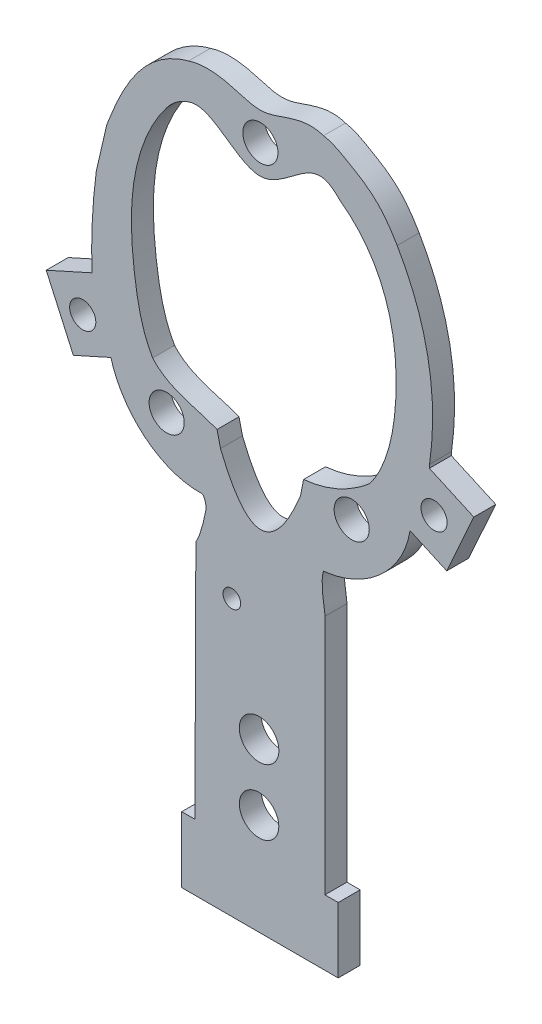
from build123d import *

# Parameters (mm, degrees)
BOSS_EXTRUDE1_START   = -1
SKETCH1_R             = 0.8
BOSS_EXTRUDE1_DEPTH   = 1
SKETCH7_R             = 0.898548633
SKETCH7_R_2           = 0.900820611
SKETCH7_R_3           = 0.402256278
CUT_EXTRUDE9_DEPTH    = 10
F_0_80_TAPPED_HOLE2_D = 1.19126
F_0_80_TAPPED_HOLE3_D = 1.19126


with BuildPart() as part:
    # Sketch1 → Boss-Extrude1 (new body)
    with BuildSketch(Plane.XY.offset(BOSS_EXTRUDE1_START)):
        with BuildLine():
            Line((-7.655924922, -1.783859884), (-9.740911438, -2.722813484))
            Line((-9.740911438, -2.722813484), (-8.506978823, -5.462813484))
            Line((-8.506978823, -5.462813484), (-6.79791054, -4.69315104))
            add(Edge.make_bspline(
                [(-2.619308836, -7.990994312), (-4.588919021, -8.061513983), (-6.291403266, -6.510208965), (-6.79791054, -4.69315104)],
                knots=[0, 0, 0, 0, 1, 1, 1, 1], degree=3))
            add(Edge.make_bspline(
                [(-2.619308836, -7.990994312), (-2.465518072, -8.186748708), (-2.460868626, -8.496086459)],
                knots=[0.760656089, 0.760656089, 0.760656089, 1, 1, 1], degree=2))
            add(Edge.make_bspline(
                [(-2.460868626, -8.496086459), (-2.65493709, -9.55970155), (-2.927067031, -10.028695592)],
                knots=[0.505400696, 0.505400696, 0.505400696, 1, 1, 1], degree=2))
            Line((-2.927067031, -10.028695592), (-2.968919318, -20.993587767))
            Line((-2.968919318, -20.993587767), (-3.569337553, -20.993587767))
            Line((-3.569337553, -20.993587767), (-3.569337553, -23.990261353))
            Line((-3.569337553, -23.990261353), (3.556946411, -23.990261353))
            Line((3.556946411, -23.990261353), (3.556946411, -21.012656051))
            Line((3.556946411, -21.012656051), (2.952210653, -21.012656051))
            Line((2.952210653, -21.012656051), (2.952210653, -10.028695592))
            add(Edge.make_bspline(
                [(2.952210653, -10.028695592), (2.953361032, -9.730287058), (2.715766736, -8.848177203), (2.885688703, -8.273229584)],
                knots=[0, 0, 0, 0, 0.672395154, 0.672395154, 0.672395154, 0.672395154], degree=3))
            add(Edge.make_bspline(
                [(6.826829986, -4.71005972), (6.530666267, -6.607497463), (4.761489994, -8.103944733), (2.885688703, -8.273229584)],
                knots=[0, 0, 0, 0, 1, 1, 1, 1], degree=3))
            Line((6.826829986, -4.71005972), (8.498351825, -5.462813484))
            Line((8.498351825, -5.462813484), (9.73228444, -2.722813484))
            Line((9.73228444, -2.722813484), (7.707819022, -1.811114978))
            Line((7.707819022, -1.811114978), (7.717081791, -1.649283667))
            add(Edge.make_bspline(
                [(6.242730234, 6.243460256), (8.328472862, 2.657233336), (7.717081791, -1.649283667)],
                knots=[0, 0, 0, 1, 1, 1], degree=2))
            add(Edge.make_bspline(
                [(2.888581262, 8.896214027), (2.985217378, 8.879515932), (3.247765026, 8.808593113), (3.630118411, 8.642577), (4.074173184, 8.36866418), (4.721906948, 8.009989726), (5.550196572, 7.346039296), (6.012892554, 6.633136043), (6.242724869, 6.243469352), (6.242730234, 6.243460256)],
                knots=[0.680120302, 0.680120302, 0.680120302, 0.680120302, 0.700211116, 0.734681827, 0.764415496, 0.805837959, 0.884920242, 0.976406366, 0.976408502, 0.976408502, 0.976408502, 0.976408502], degree=3))
            add(Edge.make_bspline(
                [(2.888581262, 8.896214027), (2.280334466, 9.102116147), (1.335962581, 8.833175098), (-0.021268554, 8.319279629), (-1.467178457, 8.865773987), (-2.595326146, 8.990746146), (-3.261769012, 8.769028641)],
                knots=[0, 0, 0, 0, 0.291998369, 0.463731226, 0.671653294, 1, 1, 1, 1], degree=3))
            add(Edge.make_bspline(
                [(-6.978349655, 4.418537245), (-6.978341175, 4.418559118), (-6.261281728, 6.267997055), (-5.356361794, 8.204922518), (-3.261769012, 8.769028641)],
                knots=[0.183710391, 0.183710391, 0.183710391, 0.183710391, 0.183719842, 0.982772692, 0.982772692, 0.982772692, 0.982772692], degree=3))
            Line((-6.978349655, 4.418537245), (-7.459962837, 2.329545769))
            add(Edge.make_bspline(
                [(-7.459962837, 2.329545769), (-7.730690273, 0.280095873), (-7.655924922, -1.783859884)],
                knots=[0, 0, 0, 1, 1, 1], degree=2))
        make_face()
        with Locations((-4.256541488, -5.597749713)):
            Circle(SKETCH1_R, mode=Mode.SUBTRACT)
        with Locations((4.170722828, -5.597749713)):
            Circle(SKETCH1_R, mode=Mode.SUBTRACT)
        with BuildLine():
            add(Edge.make_bspline(
                [(-1.804027034, -5.787976133), (0.02164308, -10.328457974), (1.839505032, -5.833009783)],
                knots=[0, 0, 0, 1, 1, 1], degree=2))
            Line((-1.804027034, -5.787976133), (-1.962380096, -5.114496208))
            add(Edge.make_bspline(
                [(-1.962380096, -5.114496208), (-2.941705535, -4.714827932), (-4.153358989, -4.614522903), (-4.895639487, -3.761606791)],
                knots=[0, 0, 0, 0, 1, 1, 1, 1], degree=3))
            add(Edge.make_bspline(
                [(-4.256541488, 6.424442026), (-5.024773734, 5.435848631), (-5.987106297, 2.960839001), (-5.849347194, -0.56805471), (-5.37593872, -2.947032062), (-4.895639487, -3.761606791)],
                knots=[0, 0, 0, 0, 0.272445914, 0.556070127, 0.771313395, 0.771313395, 0.771313395, 0.771313395], degree=3))
            add(Edge.make_bspline(
                [(-3.261769012, 7.15739827), (-3.8717566, 6.941904365), (-4.256541488, 6.424442026)],
                knots=[0, 0, 0, 1, 1, 1], degree=2))
            add(Edge.make_bspline(
                [(-3.261769012, 7.15739827), (-3.163039034, 7.19003027), (-2.117380019, 7.410646221), (0.07712388, 4.390116457), (2.247368009, 7.809908036), (3.370301543, 6.988790875), (3.593464255, 6.757042923)],
                knots=[0.223669574, 0.223669574, 0.223669574, 0.223669574, 0.250320471, 0.504380952, 0.76319614, 0.835276292, 0.835276292, 0.835276292, 0.835276292], degree=3))
            add(Edge.make_bspline(
                [(3.593464255, 6.757042923), (5.644175861, 5.268051013), (6.650840286, 1.422043117), (5.831780767, -2.644018853), (5.005569013, -3.761606791)],
                knots=[0, 0, 0, 0, 0.480405077, 0.775338814, 0.775338814, 0.775338814, 0.775338814], degree=3))
            add(Edge.make_bspline(
                [(1.979863992, -5.114496208), (3.102537491, -5.017783712), (4.162687131, -4.499401159), (5.005569013, -3.761606791)],
                knots=[0, 0, 0, 0, 1, 1, 1, 1], degree=3))
            Line((1.979863992, -5.114496208), (1.839505032, -5.833009783))
        make_face(mode=Mode.SUBTRACT)
        with Locations((0.012809238, 7.182899015)):
            Circle(SKETCH1_R, mode=Mode.SUBTRACT)
    extrude(amount=BOSS_EXTRUDE1_DEPTH)

    # Sketch7 → Cut-Extrude9 (cut)
    with BuildSketch(Plane.XY):
        with Locations((-0.047392103, -19.368039034)):
            Circle(SKETCH7_R)
        with Locations((-0.046989341, -16.376260671)):
            Circle(SKETCH7_R_2)
        with Locations((-1.287320407, -11.446362098)):
            Circle(SKETCH7_R_3)
    extrude(amount=-CUT_EXTRUDE9_DEPTH, mode=Mode.SUBTRACT)

    # #0-80 Tapped Hole2 (through all)
    with Locations(Plane(origin=(0, 0, -1), x_dir=(-1, 0, 0), z_dir=(0, 0, -1))):
        with Locations((-7.922698165, -3.556993775)):
            Hole(F_0_80_TAPPED_HOLE2_D / 2)

    # #0-80 Tapped Hole3 (through all)
    with Locations(Plane(origin=(0, 0, -1), x_dir=(-1, 0, 0), z_dir=(0, 0, -1))):
        with Locations((8.078988794, -3.645070301)):
            Hole(F_0_80_TAPPED_HOLE3_D / 2)


solid = part.part
